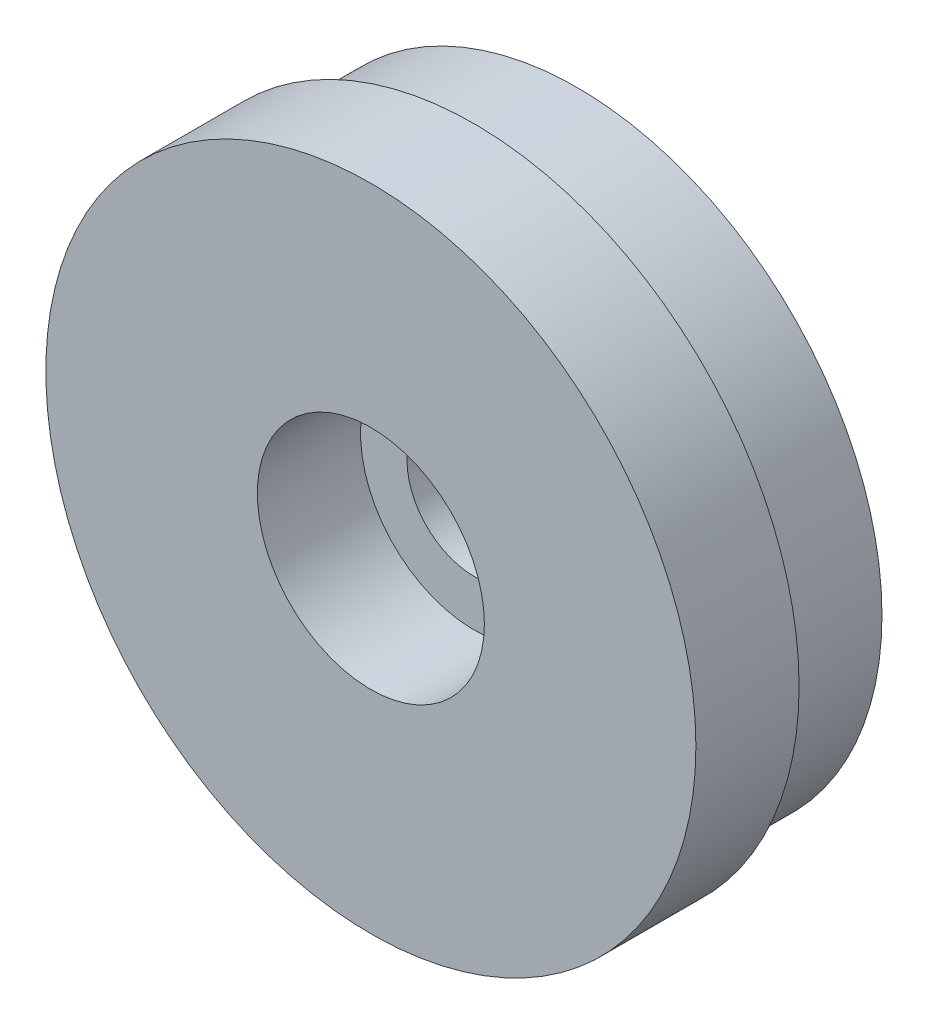
from build123d import *

# Parameters (mm, degrees)
SKETCH1_R           = 8
SKETCH1_R_2         = 2.794
BOSS_EXTRUDE1_DEPTH = 2.54
SKETCH2_R           = 7.5
SKETCH2_R_2         = 1.651
BOSS_EXTRUDE2_DEPTH = 2.54


with BuildPart() as part:
    # Sketch1 → Boss-Extrude1 (new body)
    with BuildSketch(Plane.XY):
        Circle(SKETCH1_R)
        Circle(SKETCH1_R_2, mode=Mode.SUBTRACT)
    extrude(amount=-BOSS_EXTRUDE1_DEPTH)

    # Sketch2 → Boss-Extrude2 (add)
    with BuildSketch(Plane(origin=(0, 0, -2.54), x_dir=(-1, 0, 0), z_dir=(0, 0, -1))):
        Circle(SKETCH2_R)
        Circle(SKETCH2_R_2, mode=Mode.SUBTRACT)
    extrude(amount=BOSS_EXTRUDE2_DEPTH)


solid = part.part
